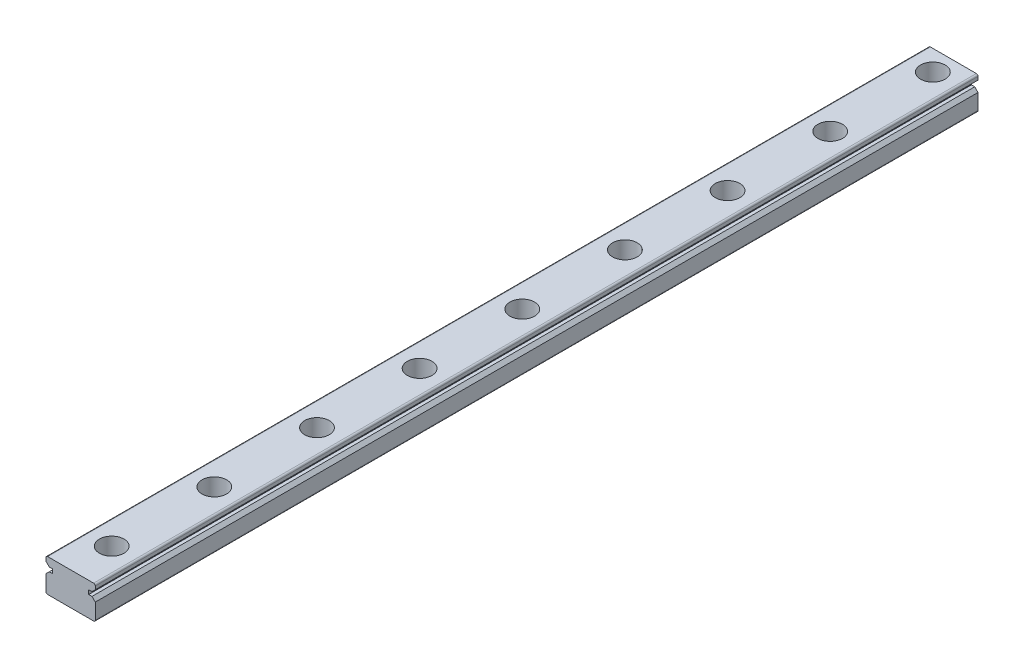
from build123d import *

# Parameters (mm, degrees)
BOSS_EXTRUDE1_DEPTH = 215
SKETCH2_R           = 3
CUT_EXTRUDE1_DEPTH  = 4.5
SKETCH3_R           = 1.75
CUT_EXTRUDE2_DEPTH  = 216.2324325


with BuildPart() as part:
    # Sketch1 → Boss-Extrude1 (new body)
    with BuildSketch(Plane.XY):
        with BuildLine():
            Line((-5.6, 4), (5.6, 4))
            ThreePointArc((5.6, 4), (5.882842712, 3.882842712), (6, 3.6))
            Line((6, 3.6), (6, 2.8))
            Line((6, 2.8), (5.2, 2))
            Line((5.2, 2), (4.4, 2))
            Line((4.4, 2), (4.4, 1))
            Line((4.4, 1), (5.2, 1))
            Line((5.2, 1), (6, 0.2))
            Line((6, 0.2), (6, -3.6))
            ThreePointArc((6, -3.6), (5.882842712, -3.882842712), (5.6, -4))
            Line((5.6, -4), (-5.6, -4))
            ThreePointArc((-5.6, -4), (-5.882842712, -3.882842712), (-6, -3.6))
            Line((-6, -3.6), (-6, 0.2))
            Line((-6, 0.2), (-5.2, 1))
            Line((-5.2, 1), (-4.4, 1))
            Line((-4.4, 1), (-4.4, 2))
            Line((-4.4, 2), (-5.2, 2))
            Line((-5.2, 2), (-6, 2.8))
            Line((-6, 2.8), (-6, 3.6))
            ThreePointArc((-6, 3.6), (-5.882842712, 3.882842712), (-5.6, 4))
        make_face()
    extrude(amount=BOSS_EXTRUDE1_DEPTH)

    # Sketch2 → Cut-Extrude1 (cut)
    with BuildSketch(Plane(origin=(0, 4, 0), x_dir=(1, 0, 0), z_dir=(0, 1, 0))):
        with Locations(Location((0, -205, 0), (0, 0, 270))):
            Circle(SKETCH2_R)
        with Locations(Location((0, -180, 0), (0, 0, 270))):
            Circle(SKETCH2_R)
        with Locations(Location((0, -155, 0), (0, 0, 270))):
            Circle(SKETCH2_R)
        with Locations(Location((0, -130, 0), (0, 0, 270))):
            Circle(SKETCH2_R)
        with Locations(Location((0, -105, 0), (0, 0, 270))):
            Circle(SKETCH2_R)
        with Locations(Location((0, -80, 0), (0, 0, 270))):
            Circle(SKETCH2_R)
        with Locations(Location((0, -55, 0), (0, 0, 270))):
            Circle(SKETCH2_R)
        with Locations(Location((0, -30, 0), (0, 0, 270))):
            Circle(SKETCH2_R)
        with Locations(Location((0, -5, 0), (0, 0, 270))):
            Circle(SKETCH2_R)
        with Locations((0, 20)):
            Circle(SKETCH2_R)
        with Locations((0, 45)):
            Circle(SKETCH2_R)
        with Locations((0, 70)):
            Circle(SKETCH2_R)
        with Locations((0, 95)):
            Circle(SKETCH2_R)
        with Locations((0, 120)):
            Circle(SKETCH2_R)
        with Locations((0, 145)):
            Circle(SKETCH2_R)
        with Locations((0, 170)):
            Circle(SKETCH2_R)
        with Locations((0, 195)):
            Circle(SKETCH2_R)
        with Locations((0, 220)):
            Circle(SKETCH2_R)
    extrude(amount=-CUT_EXTRUDE1_DEPTH, mode=Mode.SUBTRACT)

    # Sketch3 → Cut-Extrude2 (cut, through all)
    with BuildSketch(Plane(origin=(0, 4, 0), x_dir=(1, 0, 0), z_dir=(0, 1, 0))):
        with Locations(Location((0, -205.001504258, 0), (0, 0, 270))):
            Circle(SKETCH3_R)
        with Locations(Location((0, -180.001504258, 0), (0, 0, 270))):
            Circle(SKETCH3_R)
        with Locations(Location((0, -155.001504258, 0), (0, 0, 270))):
            Circle(SKETCH3_R)
        with Locations(Location((0, -130.001504258, 0), (0, 0, 270))):
            Circle(SKETCH3_R)
        with Locations(Location((0, -105.001504258, 0), (0, 0, 270))):
            Circle(SKETCH3_R)
        with Locations(Location((0, -80.001504258, 0), (0, 0, 270))):
            Circle(SKETCH3_R)
        with Locations(Location((0, -55.001504258, 0), (0, 0, 270))):
            Circle(SKETCH3_R)
        with Locations(Location((0, -30.001504258, 0), (0, 0, 270))):
            Circle(SKETCH3_R)
        with Locations(Location((0, -5.001504258, 0), (0, 0, 270))):
            Circle(SKETCH3_R)
        with Locations((0, 19.998495742)):
            Circle(SKETCH3_R)
        with Locations((0, 44.998495742)):
            Circle(SKETCH3_R)
        with Locations((0, 69.998495742)):
            Circle(SKETCH3_R)
        with Locations((0, 94.998495742)):
            Circle(SKETCH3_R)
        with Locations((0, 119.998495742)):
            Circle(SKETCH3_R)
        with Locations((0, 144.998495742)):
            Circle(SKETCH3_R)
    extrude(amount=-CUT_EXTRUDE2_DEPTH, mode=Mode.SUBTRACT)


solid = part.part
